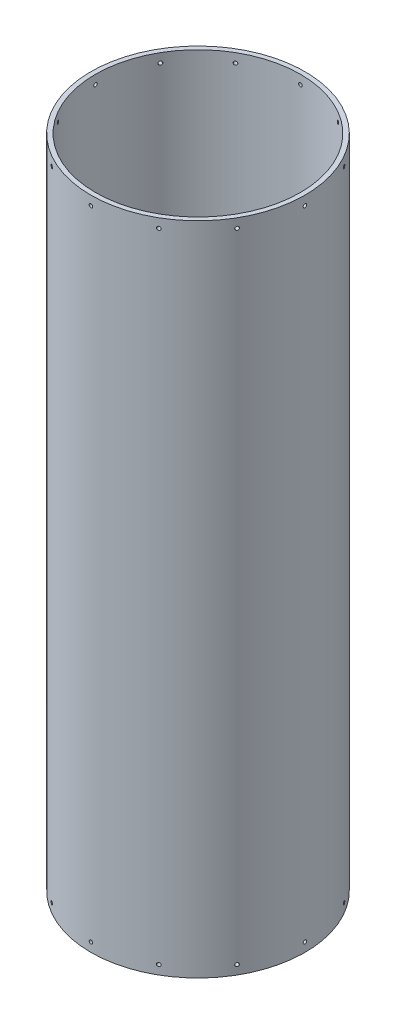
from build123d import *

# Parameters (mm, degrees)
SKETCH1_R                         = 149.225
SKETCH1_R_2                       = 142.875
BOSS_EXTRUDE1_DEPTH               = 914.4
F_10_0_1935_DIAMETER_HOLE1_REACH  = 975.38
F_10_0_1935_DIAMETER_HOLE1_BORE_R = 2.45745
CIRPATTERN1_COUNT                 = 12
MIRROR1_COPY_1_REACH              = 975.38
MIRROR1_COPY_1_SKETCH_R           = 2.45745
MIRROR1_COPY_2_REACH              = 975.38
MIRROR1_COPY_2_SKETCH_R           = 2.45745
MIRROR1_COPY_3_REACH              = 975.38
MIRROR1_COPY_3_SKETCH_R           = 2.45745
MIRROR1_COPY_4_REACH              = 975.38
MIRROR1_COPY_4_SKETCH_R           = 2.45745
MIRROR1_COPY_5_REACH              = 975.38
MIRROR1_COPY_5_SKETCH_R           = 2.45745
MIRROR1_COPY_6_REACH              = 975.38
MIRROR1_COPY_6_SKETCH_R           = 2.45745
MIRROR1_COPY_7_REACH              = 975.38
MIRROR1_COPY_7_SKETCH_R           = 2.45745
MIRROR1_COPY_8_REACH              = 975.38
MIRROR1_COPY_8_SKETCH_R           = 2.45745
MIRROR1_COPY_9_REACH              = 975.38
MIRROR1_COPY_9_SKETCH_R           = 2.45745
MIRROR1_COPY_10_REACH             = 975.38
MIRROR1_COPY_10_SKETCH_R          = 2.45745
MIRROR1_COPY_11_REACH             = 975.38
MIRROR1_COPY_11_SKETCH_R          = 2.45745


with BuildPart() as part:
    # Sketch1 → Boss-Extrude1 (new body)
    with BuildSketch(Plane(origin=(0, 0, 0), x_dir=(1, 0, 0), z_dir=(0, 1, 0))):
        with Locations(Location((0, 0, 0), (0, 0, 270))):
            Circle(SKETCH1_R)
        with Locations(Location((0, 0, 0), (0, 0, 270))):
            Circle(SKETCH1_R_2, mode=Mode.SUBTRACT)
    extrude(amount=BOSS_EXTRUDE1_DEPTH)

    # #10 (0.1935) Diameter Hole1 bore → #10 (0.1935) Diameter Hole1 (cut, up to next)
    with BuildSketch(Plane(origin=(149.225, 0, 0), x_dir=(0, 0, -1), z_dir=(1, 0, 0)), mode=Mode.PRIVATE) as f_10_0_1935_diameter_hole1_sk1:
        with Locations((0, 901.7)):
            Circle(F_10_0_1935_DIAMETER_HOLE1_BORE_R)
    f_10_0_1935_diameter_hole1_tool1 = extrude(f_10_0_1935_diameter_hole1_sk1.sketch, amount=-F_10_0_1935_DIAMETER_HOLE1_REACH, mode=Mode.PRIVATE) & part.part
    f_10_0_1935_diameter_hole1 = f_10_0_1935_diameter_hole1_tool1.solids().sort_by_distance((149.225, 901.7, 0))[0]
    add(f_10_0_1935_diameter_hole1, mode=Mode.SUBTRACT)

    # CirPattern1: #10 (0.1935) Diameter Hole1 ×12 about axis
    cirpattern1_axis = Axis((0, 914.4, 0), (0, 1, 0))
    for i in range(1, CIRPATTERN1_COUNT):
        add(f_10_0_1935_diameter_hole1.rotate(cirpattern1_axis, i * 360 / CIRPATTERN1_COUNT), mode=Mode.SUBTRACT)

    # Mirror1: #10 (0.1935) Diameter Hole1 across plane
    add(f_10_0_1935_diameter_hole1.mirror(Plane(origin=(0, 457.2, 0), x_dir=(0, 0, 1), z_dir=(0, -1, 0))), mode=Mode.SUBTRACT)

    # Mirror1 copy 1 sketch → Mirror1 copy 1 (cut, up to next)
    with BuildSketch(Plane(origin=(129.23264088, 914.4, -74.6125), x_dir=(-0.49999999999999994, 0, -0.8660254037844387), z_dir=(0.8660254037844387, 0, -0.49999999999999994)), mode=Mode.PRIVATE) as mirror1_copy_1_sk1:
        with Locations((0, -901.7)):
            Circle(MIRROR1_COPY_1_SKETCH_R)
    mirror1_copy_1_tool1 = extrude(mirror1_copy_1_sk1.sketch, amount=-MIRROR1_COPY_1_REACH, mode=Mode.PRIVATE) & part.part
    add(mirror1_copy_1_tool1.solids().sort_by_distance((129.23264088, 12.7, -74.6125))[0], mode=Mode.SUBTRACT)

    # Mirror1 copy 2 sketch → Mirror1 copy 2 (cut, up to next)
    with BuildSketch(Plane(origin=(74.6125, 914.4, -129.23264088), x_dir=(-0.8660254037844386, 0, -0.5000000000000001), z_dir=(0.5000000000000001, 0, -0.8660254037844386)), mode=Mode.PRIVATE) as mirror1_copy_2_sk1:
        with Locations((0, -901.7)):
            Circle(MIRROR1_COPY_2_SKETCH_R)
    mirror1_copy_2_tool1 = extrude(mirror1_copy_2_sk1.sketch, amount=-MIRROR1_COPY_2_REACH, mode=Mode.PRIVATE) & part.part
    add(mirror1_copy_2_tool1.solids().sort_by_distance((74.6125, 12.7, -129.23264088))[0], mode=Mode.SUBTRACT)

    # Mirror1 copy 3 sketch → Mirror1 copy 3 (cut, up to next)
    with BuildSketch(Plane(origin=(0, 914.4, -149.225), x_dir=(-1, 0, 0), z_dir=(0, 0, -1)), mode=Mode.PRIVATE) as mirror1_copy_3_sk1:
        with Locations((0, -901.7)):
            Circle(MIRROR1_COPY_3_SKETCH_R)
    mirror1_copy_3_tool1 = extrude(mirror1_copy_3_sk1.sketch, amount=-MIRROR1_COPY_3_REACH, mode=Mode.PRIVATE) & part.part
    add(mirror1_copy_3_tool1.solids().sort_by_distance((0, 12.7, -149.225))[0], mode=Mode.SUBTRACT)

    # Mirror1 copy 4 sketch → Mirror1 copy 4 (cut, up to next)
    with BuildSketch(Plane(origin=(-74.6125, 914.4, -129.23264088), x_dir=(-0.8660254037844387, 0, 0.4999999999999998), z_dir=(-0.4999999999999998, 0, -0.8660254037844387)), mode=Mode.PRIVATE) as mirror1_copy_4_sk1:
        with Locations((0, -901.7)):
            Circle(MIRROR1_COPY_4_SKETCH_R)
    mirror1_copy_4_tool1 = extrude(mirror1_copy_4_sk1.sketch, amount=-MIRROR1_COPY_4_REACH, mode=Mode.PRIVATE) & part.part
    add(mirror1_copy_4_tool1.solids().sort_by_distance((-74.6125, 12.7, -129.23264088))[0], mode=Mode.SUBTRACT)

    # Mirror1 copy 5 sketch → Mirror1 copy 5 (cut, up to next)
    with BuildSketch(Plane(origin=(-129.23264088, 914.4, -74.6125), x_dir=(-0.49999999999999994, 0, 0.8660254037844387), z_dir=(-0.8660254037844387, 0, -0.49999999999999994)), mode=Mode.PRIVATE) as mirror1_copy_5_sk1:
        with Locations((0, -901.7)):
            Circle(MIRROR1_COPY_5_SKETCH_R)
    mirror1_copy_5_tool1 = extrude(mirror1_copy_5_sk1.sketch, amount=-MIRROR1_COPY_5_REACH, mode=Mode.PRIVATE) & part.part
    add(mirror1_copy_5_tool1.solids().sort_by_distance((-129.23264088, 12.7, -74.6125))[0], mode=Mode.SUBTRACT)

    # Mirror1 copy 6 sketch → Mirror1 copy 6 (cut, up to next)
    with BuildSketch(Plane(origin=(-149.225, 914.4, 0), x_dir=(0, 0, 1), z_dir=(-1, 0, 0)), mode=Mode.PRIVATE) as mirror1_copy_6_sk1:
        with Locations((0, -901.7)):
            Circle(MIRROR1_COPY_6_SKETCH_R)
    mirror1_copy_6_tool1 = extrude(mirror1_copy_6_sk1.sketch, amount=-MIRROR1_COPY_6_REACH, mode=Mode.PRIVATE) & part.part
    add(mirror1_copy_6_tool1.solids().sort_by_distance((-149.225, 12.7, 0))[0], mode=Mode.SUBTRACT)

    # Mirror1 copy 7 sketch → Mirror1 copy 7 (cut, up to next)
    with BuildSketch(Plane(origin=(-129.23264088, 914.4, 74.6125), x_dir=(0.5000000000000001, 0, 0.8660254037844386), z_dir=(-0.8660254037844386, 0, 0.5000000000000001)), mode=Mode.PRIVATE) as mirror1_copy_7_sk1:
        with Locations((0, -901.7)):
            Circle(MIRROR1_COPY_7_SKETCH_R)
    mirror1_copy_7_tool1 = extrude(mirror1_copy_7_sk1.sketch, amount=-MIRROR1_COPY_7_REACH, mode=Mode.PRIVATE) & part.part
    add(mirror1_copy_7_tool1.solids().sort_by_distance((-129.23264088, 12.7, 74.6125))[0], mode=Mode.SUBTRACT)

    # Mirror1 copy 8 sketch → Mirror1 copy 8 (cut, up to next)
    with BuildSketch(Plane(origin=(-74.6125, 914.4, 129.23264088), x_dir=(0.8660254037844384, 0, 0.5000000000000004), z_dir=(-0.5000000000000004, 0, 0.8660254037844384)), mode=Mode.PRIVATE) as mirror1_copy_8_sk1:
        with Locations((0, -901.7)):
            Circle(MIRROR1_COPY_8_SKETCH_R)
    mirror1_copy_8_tool1 = extrude(mirror1_copy_8_sk1.sketch, amount=-MIRROR1_COPY_8_REACH, mode=Mode.PRIVATE) & part.part
    add(mirror1_copy_8_tool1.solids().sort_by_distance((-74.6125, 12.7, 129.23264088))[0], mode=Mode.SUBTRACT)

    # Mirror1 copy 9 sketch → Mirror1 copy 9 (cut, up to next)
    with BuildSketch(Plane(origin=(0, 914.4, 149.225), x_dir=(1, 0, 0), z_dir=(0, 0, 1)), mode=Mode.PRIVATE) as mirror1_copy_9_sk1:
        with Locations((0, -901.7)):
            Circle(MIRROR1_COPY_9_SKETCH_R)
    mirror1_copy_9_tool1 = extrude(mirror1_copy_9_sk1.sketch, amount=-MIRROR1_COPY_9_REACH, mode=Mode.PRIVATE) & part.part
    add(mirror1_copy_9_tool1.solids().sort_by_distance((0, 12.7, 149.225))[0], mode=Mode.SUBTRACT)

    # Mirror1 copy 10 sketch → Mirror1 copy 10 (cut, up to next)
    with BuildSketch(Plane(origin=(74.6125, 914.4, 129.23264088), x_dir=(0.8660254037844386, 0, -0.5000000000000001), z_dir=(0.5000000000000001, 0, 0.8660254037844386)), mode=Mode.PRIVATE) as mirror1_copy_10_sk1:
        with Locations((0, -901.7)):
            Circle(MIRROR1_COPY_10_SKETCH_R)
    mirror1_copy_10_tool1 = extrude(mirror1_copy_10_sk1.sketch, amount=-MIRROR1_COPY_10_REACH, mode=Mode.PRIVATE) & part.part
    add(mirror1_copy_10_tool1.solids().sort_by_distance((74.6125, 12.7, 129.23264088))[0], mode=Mode.SUBTRACT)

    # Mirror1 copy 11 sketch → Mirror1 copy 11 (cut, up to next)
    with BuildSketch(Plane(origin=(129.23264088, 914.4, 74.6125), x_dir=(0.5000000000000004, 0, -0.8660254037844384), z_dir=(0.8660254037844384, 0, 0.5000000000000004)), mode=Mode.PRIVATE) as mirror1_copy_11_sk1:
        with Locations((0, -901.7)):
            Circle(MIRROR1_COPY_11_SKETCH_R)
    mirror1_copy_11_tool1 = extrude(mirror1_copy_11_sk1.sketch, amount=-MIRROR1_COPY_11_REACH, mode=Mode.PRIVATE) & part.part
    add(mirror1_copy_11_tool1.solids().sort_by_distance((129.23264088, 12.7, 74.6125))[0], mode=Mode.SUBTRACT)


solid = part.part
